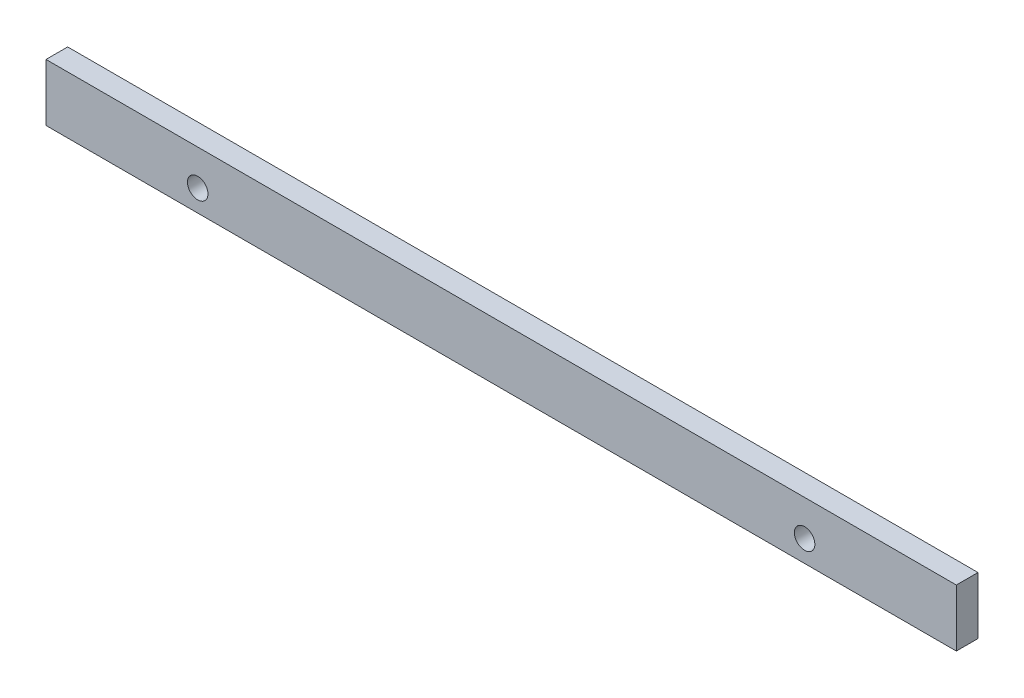
from build123d import *

# Parameters (mm, degrees)
SKETCH3_W           = 133.35
SKETCH3_H           = 8.382
SKETCH3_R           = 1.5
BOSS_EXTRUDE1_DEPTH = 3.175


with BuildPart() as part:
    # Sketch3 → Boss-Extrude1 (new body)
    with BuildSketch(Plane.XY):
        Rectangle(SKETCH3_W, SKETCH3_H)
        with Locations((44.45, -1.016)):
            Circle(SKETCH3_R, mode=Mode.SUBTRACT)
        with Locations((-44.45, -1.016)):
            Circle(SKETCH3_R, mode=Mode.SUBTRACT)
    extrude(amount=BOSS_EXTRUDE1_DEPTH)


solid = part.part
